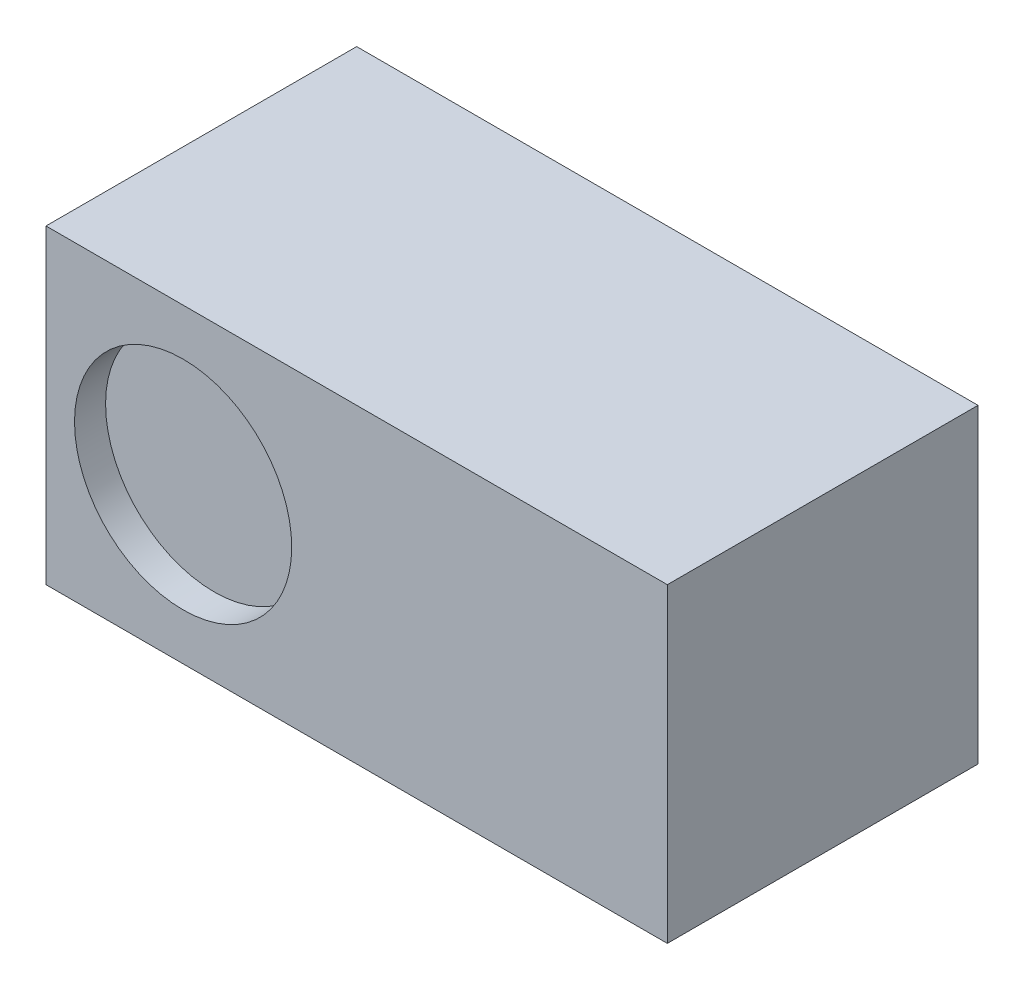
from build123d import *

# Parameters (mm, degrees)
SKETCH1_W           = 50.8
SKETCH1_H           = 25.4
BOSS_EXTRUDE1_DEPTH = 25.4
SKETCH2_R           = 8.879230805
CUT_EXTRUDE1_DEPTH  = 2.54


with BuildPart() as part:
    # Sketch1 → Boss-Extrude1 (new body)
    with BuildSketch(Plane.XY):
        Rectangle(SKETCH1_W, SKETCH1_H)
    extrude(amount=BOSS_EXTRUDE1_DEPTH)

    # Sketch2 → Cut-Extrude1 (cut)
    with BuildSketch(Plane.XY.offset(25.4)):
        with Locations((-14.189614604, 0)):
            Circle(SKETCH2_R)
    extrude(amount=-CUT_EXTRUDE1_DEPTH, mode=Mode.SUBTRACT)


solid = part.part
